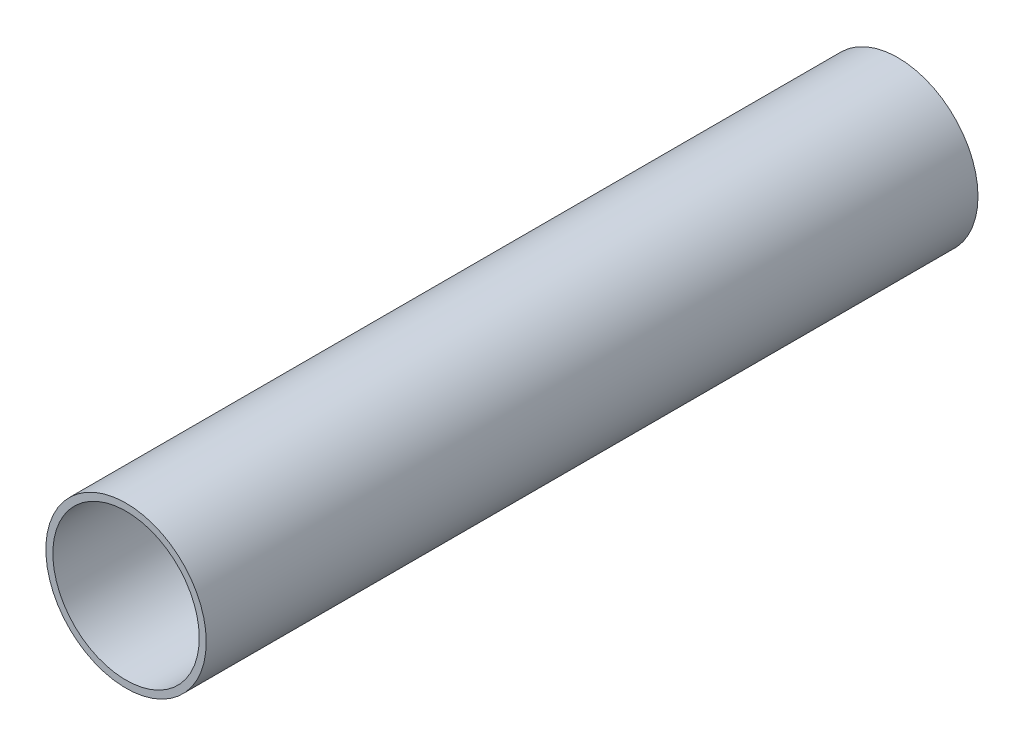
from build123d import *

# Parameters (mm, degrees)
SKETCH1_R           = 34.925
SKETCH1_R_2         = 31.877
BOSS_EXTRUDE1_DEPTH = 336.0668


with BuildPart() as part:
    # Sketch1 → Boss-Extrude1 (new body)
    with BuildSketch(Plane.XY):
        Circle(SKETCH1_R)
        Circle(SKETCH1_R_2, mode=Mode.SUBTRACT)
    extrude(amount=BOSS_EXTRUDE1_DEPTH)


solid = part.part
